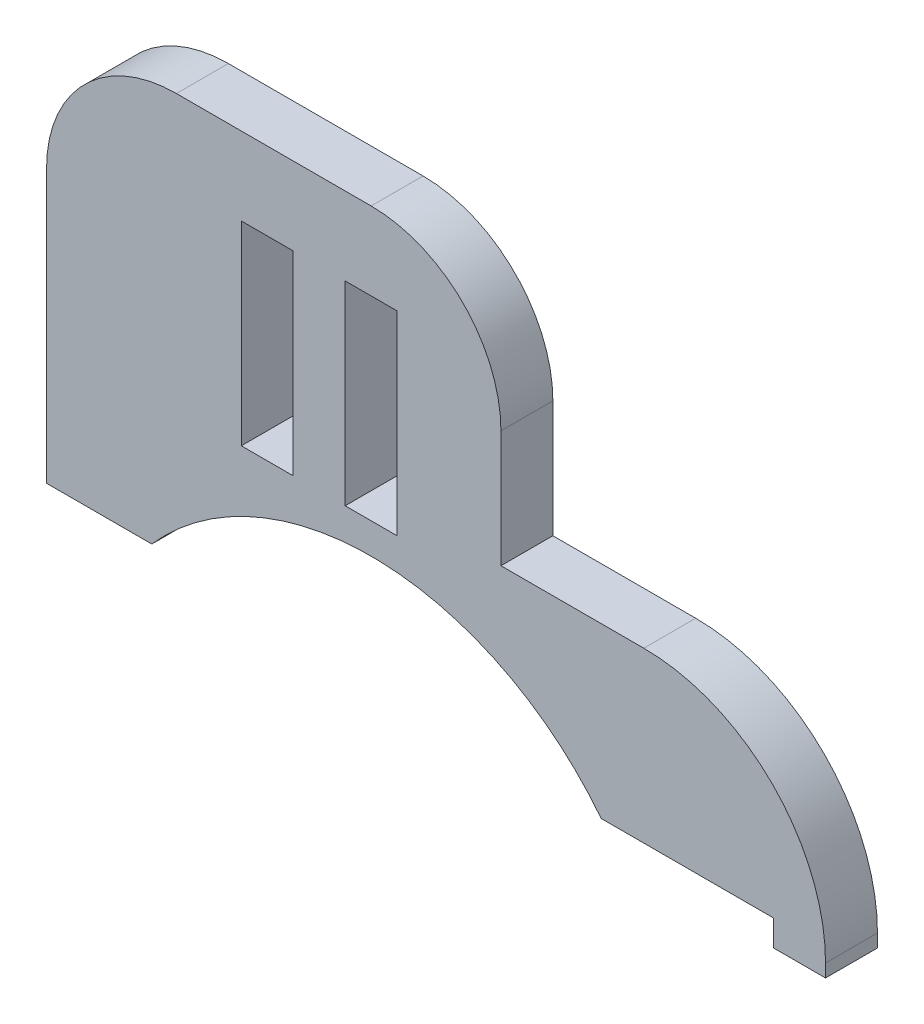
from build123d import *

# Parameters (mm, degrees)
SKETCH1_W           = 76.2
SKETCH1_H           = 15.24
BOSS_EXTRUDE1_DEPTH = 5.08
SKETCH2_W           = 25.4
SKETCH2_H           = 5.08
BOSS_EXTRUDE2_DEPTH = 31.75
SKETCH4_W           = 5.08
SKETCH4_H           = 19.05
CUT_EXTRUDE2_DEPTH  = 50.8
SKETCH6_W           = 5.08
SKETCH6_H           = 34.29
BOSS_EXTRUDE3_DEPTH = 19.05
SKETCH7_W           = 5.08
SKETCH7_H           = 19.05
CUT_EXTRUDE4_DEPTH  = 19.05
FILLET1_R           = 12.7
SKETCH12_W          = 5.08
SKETCH12_H          = 5.08
BOSS_EXTRUDE5_DEPTH = 3.81
SKETCH14_W          = 31.440322014
SKETCH14_H          = 5.08
BOSS_EXTRUDE7_DEPTH = 1.27
CUT_EXTRUDE7_DEPTH  = 50.854577523
FILLET3_R           = 17.78


with BuildPart() as part:
    # Sketch1 → Boss-Extrude1 (new body)
    with BuildSketch(Plane.XY):
        Rectangle(SKETCH1_W, SKETCH1_H)
    extrude(amount=BOSS_EXTRUDE1_DEPTH)

    # Sketch2 → Boss-Extrude2 (add)
    with BuildSketch(Plane(origin=(0, 0, 0), x_dir=(1, 0, 0), z_dir=(0, 1, 0))):
        with Locations((-6.35, -2.54)):
            Rectangle(SKETCH2_W, SKETCH2_H)
    extrude(amount=BOSS_EXTRUDE2_DEPTH)

    # Sketch4 → Cut-Extrude2 (cut)
    with BuildSketch(Plane(origin=(0, 0, 0), x_dir=(-1, 0, 0), z_dir=(0, 0, -1))):
        with Locations((6.35, 14.605)):
            Rectangle(SKETCH4_W, SKETCH4_H)
    extrude(amount=-CUT_EXTRUDE2_DEPTH, mode=Mode.SUBTRACT)

    # Sketch6 → Boss-Extrude3 (add)
    with BuildSketch(Plane.ZY.offset(19.05)):
        with Locations((2.54, 14.605)):
            Rectangle(SKETCH6_W, SKETCH6_H)
    extrude(amount=BOSS_EXTRUDE3_DEPTH)

    # Sketch7 → Cut-Extrude4 (cut)
    with BuildSketch(Plane(origin=(0, 0, 0), x_dir=(-1, 0, 0), z_dir=(0, 0, -1))):
        with Locations((16.51, 14.605)):
            Rectangle(SKETCH7_W, SKETCH7_H)
    extrude(amount=-CUT_EXTRUDE4_DEPTH, mode=Mode.SUBTRACT)

    # Fillet1
    fillet1_edges = [part.edges().sort_by_distance(p)[0] for p in [
        (6.35, 31.75, 2.54),
        (-38.1, 31.75, 2.54),
    ]]
    fillet(fillet1_edges, radius=FILLET1_R)

    # Sketch12 → Boss-Extrude5 (add)
    with BuildSketch(Plane.XZ.offset(7.62)):
        with Locations((35.56, 2.54)):
            Rectangle(SKETCH12_W, SKETCH12_H)
    extrude(amount=BOSS_EXTRUDE5_DEPTH)

    # Sketch14 → Boss-Extrude7 (add)
    with BuildSketch(Plane.XZ.offset(7.62)):
        with Locations((17.299838993, 2.54)):
            Rectangle(SKETCH14_W, SKETCH14_H)
    extrude(amount=BOSS_EXTRUDE7_DEPTH)

    # Sketch9 → Cut-Extrude7 (cut, through all)
    with BuildSketch(Plane.XY.offset(5.08)):
        with BuildLine():
            Line((22.048333309, -23.322415838), (-34.748333309, -23.322415838))
            ThreePointArc((-34.748333309, -23.322415838), (-25.400905918, -5.197262826), (-6.35, 2.08))
            ThreePointArc((-6.35, 2.08), (12.700905918, -5.197262826), (22.048333309, -23.322415838))
        make_face()
    extrude(amount=-CUT_EXTRUDE7_DEPTH, mode=Mode.SUBTRACT)

    # Fillet3
    fillet3_edges = [part.edges().sort_by_distance(p)[0] for p in [
        (38.1, 7.62, 2.54),
    ]]
    fillet(fillet3_edges, radius=FILLET3_R)


solid = part.part
